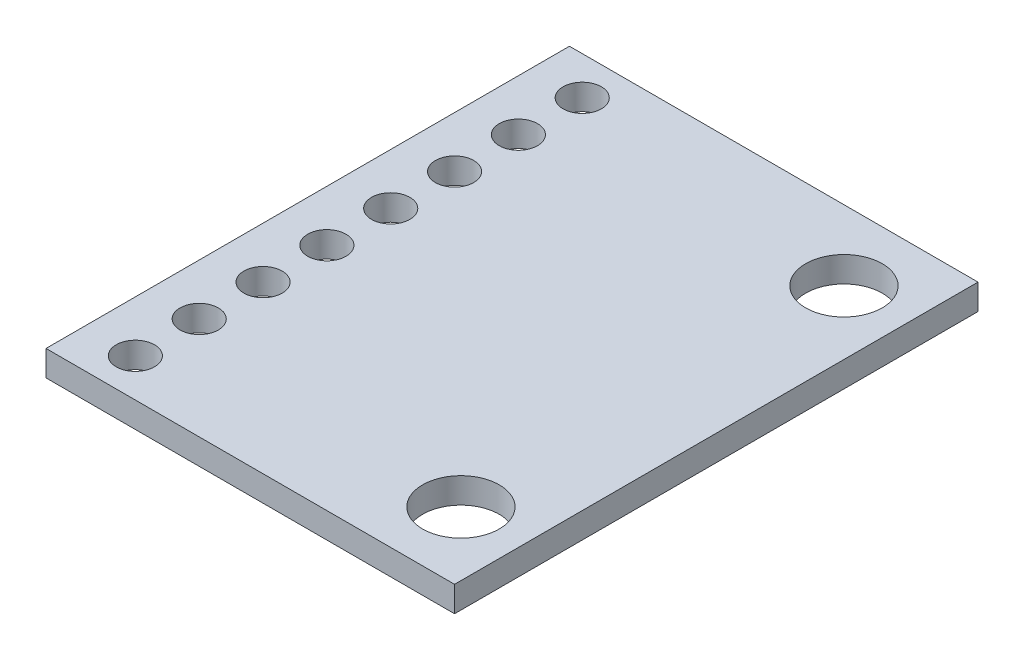
from build123d import *

# Parameters (mm, degrees)
SKETCH1_W           = 16
SKETCH1_H           = 20.5
SKETCH1_R           = 1.5
BOSS_EXTRUDE1_DEPTH = 1
SKETCH2_R           = 0.75
CUT_EXTRUDE2_DEPTH  = 14.040801356


with BuildPart() as part:
    # Sketch1 → Boss-Extrude1 (new body)
    with BuildSketch(Plane(origin=(0, 0, 0), x_dir=(1, 0, 0), z_dir=(0, 1, 0))):
        Rectangle(SKETCH1_W, SKETCH1_H)
        with Locations(Location((5.5, 7.5, 0), (0, 0, 270))):
            Circle(SKETCH1_R, mode=Mode.SUBTRACT)
        with Locations(Location((5.5, -7.5, 0), (0, 0, 270))):
            Circle(SKETCH1_R, mode=Mode.SUBTRACT)
    extrude(amount=BOSS_EXTRUDE1_DEPTH)

    # Sketch2 → Cut-Extrude2 (cut, through all)
    with BuildSketch(Plane(origin=(0, 1, 0), x_dir=(1, 0, 0), z_dir=(0, 1, 0))):
        with Locations(Location((-6, 8.75, 0), (0, 0, 270))):
            Circle(SKETCH2_R)
        with Locations(Location((-6, 6.25, 0), (0, 0, 270))):
            Circle(SKETCH2_R)
        with Locations(Location((-6, 3.75, 0), (0, 0, 270))):
            Circle(SKETCH2_R)
        with Locations(Location((-6, 1.25, 0), (0, 0, 270))):
            Circle(SKETCH2_R)
        with Locations(Location((-6, -1.25, 0), (0, 0, 270))):
            Circle(SKETCH2_R)
        with Locations(Location((-6, -3.75, 0), (0, 0, 270))):
            Circle(SKETCH2_R)
        with Locations(Location((-6, -6.25, 0), (0, 0, 270))):
            Circle(SKETCH2_R)
        with Locations(Location((-6, -8.75, 0), (0, 0, 270))):
            Circle(SKETCH2_R)
    extrude(amount=-CUT_EXTRUDE2_DEPTH, mode=Mode.SUBTRACT)


solid = part.part
